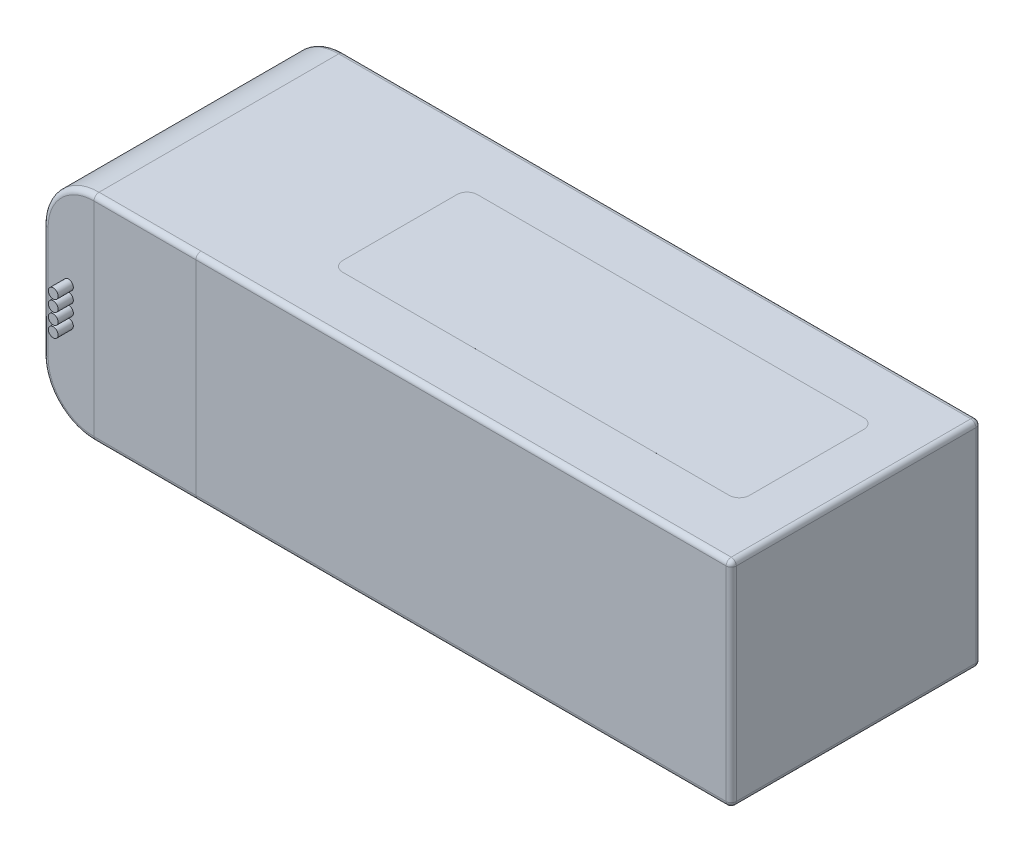
from build123d import *

# Parameters (mm, degrees)
SKETCH1_W           = 135
SKETCH1_H           = 49
BOSS_EXTRUDE1_DEPTH = 21
FILLET1_R           = 10
SKETCH2_R           = 1.9
BOSS_EXTRUDE2_DEPTH = 5
SKETCH4_R           = 0.95
BOSS_EXTRUDE3_DEPTH = 3
SKETCH5_W           = 20
SKETCH5_H           = 42
BOSS_EXTRUDE4_DEPTH = 0.0001
BOSS_EXTRUDE5_DEPTH = 0.0001
BOSS_EXTRUDE6_DEPTH = 0.0001
FILLET7_R           = 1
FILLET8_R           = 1


with BuildPart() as part:
    # Sketch1 → Boss-Extrude1 (new, symmetric)
    with BuildSketch(Plane(origin=(0, 0, 0), x_dir=(1, 0, 0), z_dir=(0, 1, 0))):
        Rectangle(SKETCH1_W, SKETCH1_H)
    extrude(amount=BOSS_EXTRUDE1_DEPTH, both=True)

    # Fillet1
    fillet1_edges = [part.edges().sort_by_distance(p)[0] for p in [
        (-67.5, 21, 0),
        (-67.5, -21, 0),
    ]]
    fillet(fillet1_edges, radius=FILLET1_R)

    # Sketch2 → Boss-Extrude2 (add)
    with BuildSketch(Plane(origin=(0, 0, -24.5), x_dir=(-1, 0, 0), z_dir=(0, 0, -1))):
        with Locations(Location((59.5, 3.35, 0), (0, 0, 180))):
            Circle(SKETCH2_R)
        with Locations(Location((59.5, -3.35, 0), (0, 0, 180))):
            Circle(SKETCH2_R)
    extrude(amount=BOSS_EXTRUDE2_DEPTH)

    # Sketch4 → Boss-Extrude3 (add)
    with BuildSketch(Plane.XY.offset(24.5)):
        with Locations(Location((-62.5, 3.3, 0), (0, 0, 180))):
            Circle(SKETCH4_R)
        with Locations(Location((-62.5, 1.1, 0), (0, 0, 180))):
            Circle(SKETCH4_R)
        with Locations(Location((-62.5, -1.1, 0), (0, 0, 180))):
            Circle(SKETCH4_R)
        with Locations(Location((-62.5, -3.3, 0), (0, 0, 180))):
            Circle(SKETCH4_R)
    extrude(amount=BOSS_EXTRUDE3_DEPTH)

    # Sketch5 → Boss-Extrude4 (add)
    with BuildSketch(Plane.XY.offset(24.5)):
        with Locations((-47.5, 0)):
            Rectangle(SKETCH5_W, SKETCH5_H)
    boss_extrude4 = extrude(amount=BOSS_EXTRUDE4_DEPTH)

    # Mirror1: Boss-Extrude4 across plane
    add(boss_extrude4.mirror(Plane.XY))

    # Mirror1 at the second plane: Boss-Extrude4 across plane
    add(boss_extrude4.mirror(Plane.ZX))

    # Sketch6 → Boss-Extrude5 (add)
    with BuildSketch(Plane(origin=(0, 21, 0), x_dir=(1, 0, 0), z_dir=(0, 1, 0))):
        with BuildLine():
            Line((-20, 13.2), (55.8, 13.2))
            ThreePointArc((55.8, 13.2), (57.214213562, 12.614213562), (57.8, 11.2))
            Line((57.8, 11.2), (57.8, -11.2))
            ThreePointArc((57.8, -11.2), (57.214213562, -12.614213562), (55.8, -13.2))
            Line((55.8, -13.2), (-20, -13.2))
            ThreePointArc((-20, -13.2), (-21.414213562, -12.614213562), (-22, -11.2))
            Line((-22, -11.2), (-22, 11.2))
            ThreePointArc((-22, 11.2), (-21.414213562, 12.614213562), (-20, 13.2))
        make_face()
    extrude(amount=BOSS_EXTRUDE5_DEPTH)

    # Sketch7 → Boss-Extrude6 (add)
    with BuildSketch(Plane.XZ.offset(21)):
        with BuildLine():
            Line((-8.1, 12.5), (42.8, 12.5))
            ThreePointArc((42.8, 12.5), (44.214213562, 11.914213562), (44.8, 10.5))
            Line((44.8, 10.5), (44.8, -10.5))
            ThreePointArc((44.8, -10.5), (44.214213562, -11.914213562), (42.8, -12.5))
            Line((42.8, -12.5), (-8.1, -12.5))
            ThreePointArc((-8.1, -12.5), (-9.514213562, -11.914213562), (-10.1, -10.5))
            Line((-10.1, -10.5), (-10.1, 10.5))
            ThreePointArc((-10.1, 10.5), (-9.514213562, 11.914213562), (-8.1, 12.5))
        make_face()
    extrude(amount=BOSS_EXTRUDE6_DEPTH)

    # Fillet7
    fillet7_edges = [part.edges().sort_by_distance(p)[0] for p in [
        (67.5, 21, 0),
        (-67.5, 0, 24.5),
        (-67.5, 0, -24.5),
        (15, 21, -24.5),
        (-64.571067812, 18.071067812, 24.5),
        (-64.571067812, -18.071067812, 24.5),
        (-64.571067812, 18.071067812, -24.5),
        (-64.571067812, -18.071067812, -24.5),
        (15, -21, -24.5),
        (67.5, -21, 0),
        (15, -21, 24.5),
        (15, 21, 24.5),
        (67.5, 0, -24.5),
        (67.5, 0, 24.5),
    ]]
    fillet(fillet7_edges, radius=FILLET7_R)

    # Fillet8
    fillet8_edges = [part.edges().sort_by_distance(p)[0] for p in [
        (-47.5, -21, 24.5001),
        (-47.5, 21, 24.5001),
        (-47.5, 21, -24.5001),
        (-47.5, -21, -24.5001),
    ]]
    fillet(fillet8_edges, radius=FILLET8_R)


solid = part.part
